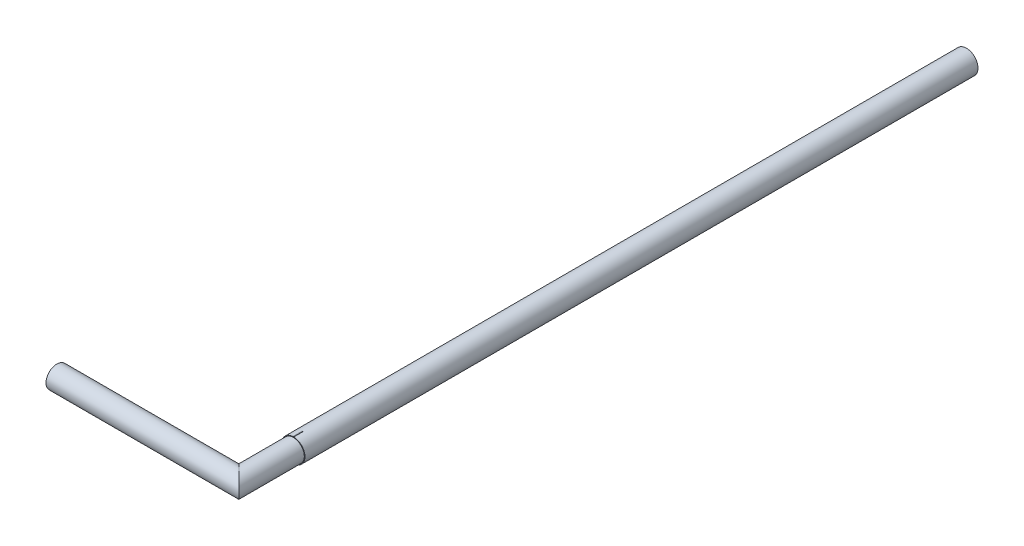
from build123d import *

# Parameters (mm, degrees)
CROQUIS1_R              = 12.7
SALIENTE_EXTRUIR1_DEPTH = 740
CROQUIS2_W              = 0.777166432
CROQUIS2_H              = 0.57610026
SALIENTE_EXTRUIR2_DEPTH = 10
CROQUIS3_R              = 12


with BuildPart() as part:
    # Croquis1 → Saliente-Extruir1 (new body)
    with BuildSketch(Plane.XY):
        Circle(CROQUIS1_R)
    extrude(amount=SALIENTE_EXTRUIR1_DEPTH)

    # Croquis2 → Saliente-Extruir2 (add)
    with BuildSketch(Plane.XY.offset(740)):
        with Locations((0, 12.7)):
            Rectangle(CROQUIS2_W, CROQUIS2_H)
    extrude(amount=-SALIENTE_EXTRUIR2_DEPTH)

    # Barrer1: sweep along a curve in space
    with BuildLine() as barrer1_path:
        Line((0, 0, 740), (0, 0, 800))
        Line((0, 0, 800), (-200, 0, 800))
    # Croquis3 → Barrer1 (sweep)
    with BuildSketch(Plane.XY.offset(740)):
        Circle(CROQUIS3_R)
    sweep(path=barrer1_path.line, transition=Transition.RIGHT)


solid = part.part
